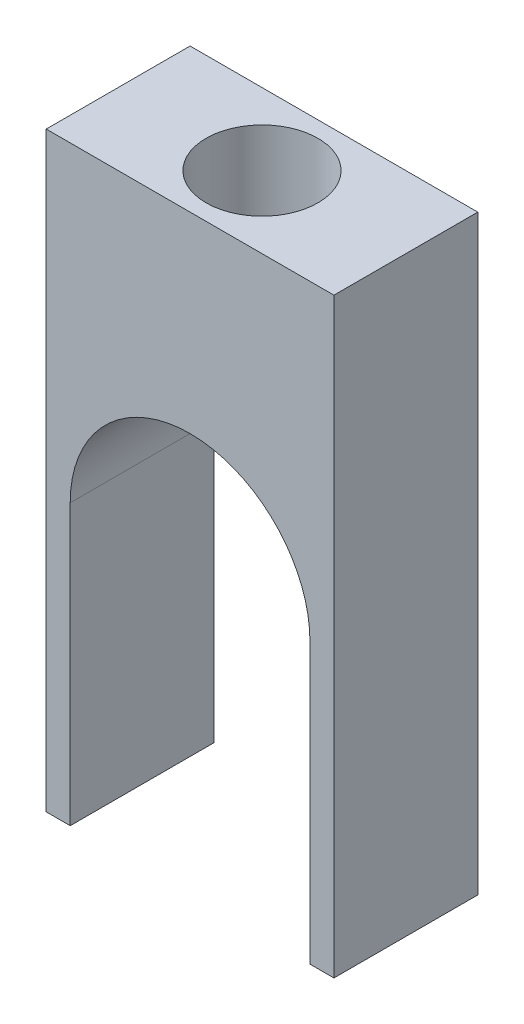
from build123d import *

# Parameters (mm, degrees)
BOSS_EXTRUDE1_DEPTH     = 18
CUT_EXTRUDE1_REACH      = 86.238
CUT_EXTRUDE1_END_RADIUS = 15
SKETCH3_R               = 7


with BuildPart() as part:
    # Sketch2 → Boss-Extrude1 (new body)
    with BuildSketch(Plane.XY):
        with BuildLine():
            Line((-33.38706816, 74), (-36, 74))
            Line((-36, 74), (-36, 0))
            Line((-36, 0), (-33, 0))
            Line((-33, 0), (-33, 35))
            ThreePointArc((-33, 35), (-18, 50), (-3, 35))
            Line((-3, 35), (-3, 0))
            Line((-3, 0), (0, 0))
            Line((0, 0), (0, 74))
            Line((0, 74), (-12.61679677, 74))
            Line((-12.61679677, 74), (-33.38706816, 74))
        make_face()
    extrude(amount=BOSS_EXTRUDE1_DEPTH)

    # Cut-Extrude1: up to this cylinder (the profile starts outside it)
    cut_extrude1_end = Plane(origin=(-18, 35, 9), z_dir=(0, 0, -1)) * Cylinder(CUT_EXTRUDE1_END_RADIUS, 203.476, mode=Mode.PRIVATE)
    # Sketch3 → Cut-Extrude1 (cut, up to the surface)
    with BuildSketch(Plane(origin=(0, 74, 0), x_dir=(1, 0, 0), z_dir=(0, 1, 0)), mode=Mode.PRIVATE) as cut_extrude1_sk1:
        with Locations(Location((-18, -9, 0), (0, 0, 270))):
            Circle(SKETCH3_R)
    cut_extrude1_tool1 = extrude(cut_extrude1_sk1.sketch, amount=-CUT_EXTRUDE1_REACH, mode=Mode.PRIVATE) - cut_extrude1_end
    add(cut_extrude1_tool1.solids().sort_by_distance((-18, 74, 9))[0], mode=Mode.SUBTRACT)


solid = part.part
